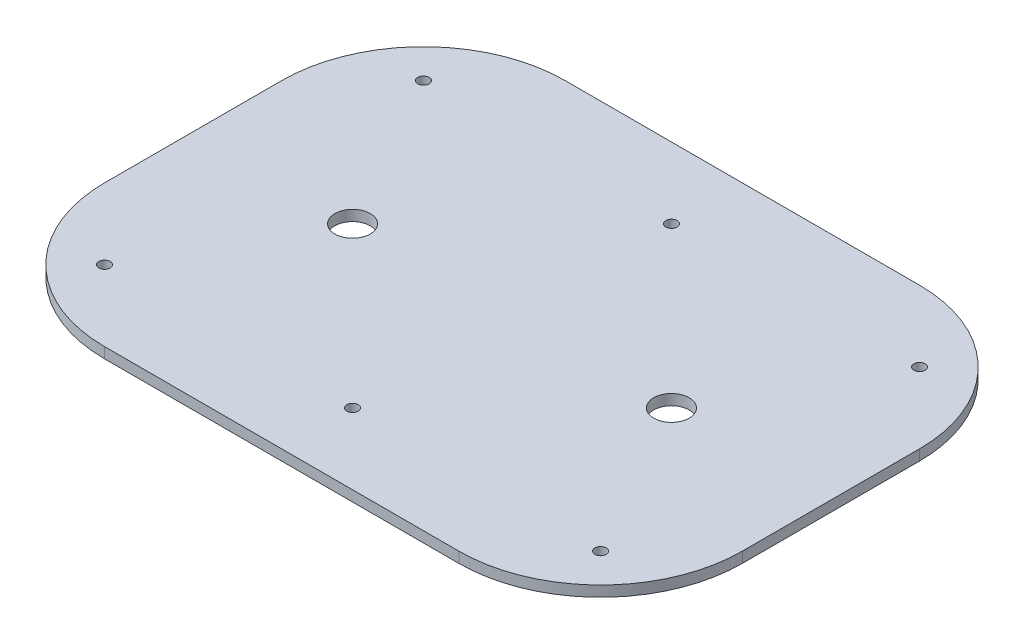
from build123d import *

# Parameters (mm, degrees)
SKETCH1_W                  = 180
SKETCH1_H                  = 130
BOSS_EXTRUDE1_DEPTH        = 3
FILLET1_R                  = 40
FILLET2_R                  = 40
F_10_0_10_DIAMETER_HOLE1_D = 10
F_3_2_3_2_DIAMETER_HOLE1_D = 3.2


with BuildPart() as part:
    # Sketch1 → Boss-Extrude1 (new body)
    with BuildSketch(Plane(origin=(0, 0, 0), x_dir=(1, 0, 0), z_dir=(0, 1, 0))):
        Rectangle(SKETCH1_W, SKETCH1_H)
    extrude(amount=BOSS_EXTRUDE1_DEPTH)

    # Fillet1
    fillet1_edges = [part.edges().sort_by_distance(p)[0] for p in [
        (-90, 1.5, 65),
        (-90, 1.5, -65),
    ]]
    fillet(fillet1_edges, radius=FILLET1_R)

    # Fillet2
    fillet2_edges = [part.edges().sort_by_distance(p)[0] for p in [
        (90, 1.5, 65),
        (90, 1.5, -65),
    ]]
    fillet(fillet2_edges, radius=FILLET2_R)

    # Ø10.0 (10) Diameter Hole1 (through all)
    with Locations(Plane(origin=(0, 3, 0), x_dir=(1, 0, 0), z_dir=(0, 1, 0))):
        with Locations((45, 0), (-45, 0)):
            Hole(F_10_0_10_DIAMETER_HOLE1_D / 2)

    # Ø3.2 (3.2) Diameter Hole1 (through all)
    with Locations(Plane(origin=(-70, 3, -45), x_dir=(0, 0, 1), z_dir=(0, 1, 0))):
        with Locations((0, 0), (0, 70), (0, 140), (90, 0), (90, 70), (90, 140)):
            Hole(F_3_2_3_2_DIAMETER_HOLE1_D / 2)


solid = part.part
